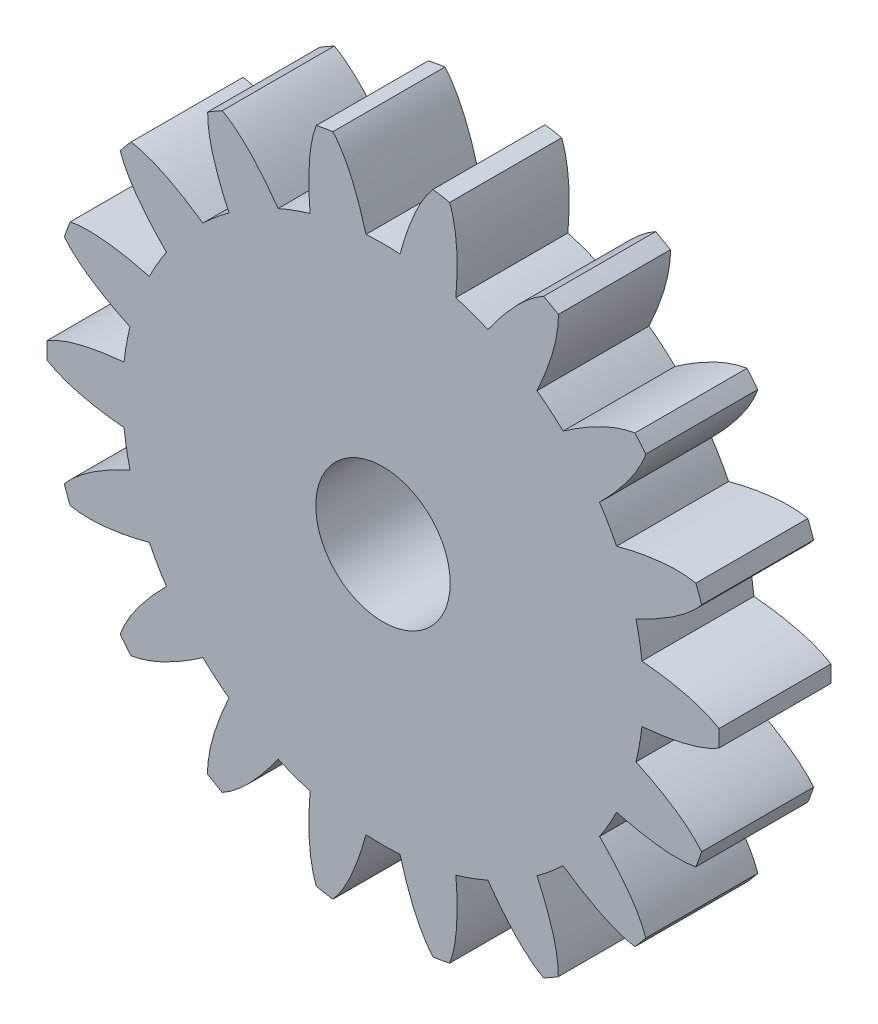
from build123d import *

# Parameters (mm, degrees)
SKETCH2_R           = 3
BOSS_EXTRUDE1_DEPTH = 5


with BuildPart() as part:
    # Sketch2 → Boss-Extrude1 (new body)
    with BuildSketch(Plane.XY):
        with BuildLine():
            ThreePointArc((-3.252993239, 11.159543494), (-3.975642146, 10.922987024), (-4.681278893, 10.639690029))
            add(Edge.make_bspline(
                [(-7.171179852, 13.174755388), (-6.030977377, 12.550803972), (-4.681278893, 10.639690029)],
                knots=[0, 0, 0, 0.715421341, 0.715421341, 0.715421341], degree=2))
            ThreePointArc((-7.171179852, 13.174755388), (-7.5, 12.990381057), (-7.824082928, 12.797801621))
            add(Edge.make_bspline(
                [(-7.824082928, 12.797801621), (-7.853826389, 11.498381604), (-6.873602407, 9.373951458)],
                knots=[0, 0, 0, 0.715421341, 0.715421341, 0.715421341], degree=2))
            ThreePointArc((-6.873602407, 9.373951458), (-7.471763175, 8.904500607), (-8.037951541, 8.39694653))
            add(Edge.make_bspline(
                [(-11.244736516, 9.927532458), (-9.95989271, 9.731182131), (-8.037951541, 8.39694653)],
                knots=[0, 0, 0, 0.715421341, 0.715421341, 0.715421341], degree=2))
            ThreePointArc((-11.244736516, 9.927532458), (-11.490666647, 9.641814145), (-11.729338937, 9.350005781))
            add(Edge.make_bspline(
                [(-11.729338937, 9.350005781), (-11.312860827, 8.118777517), (-9.665153682, 6.457722533)],
                knots=[0, 0, 0, 0.715421341, 0.715421341, 0.715421341], degree=2))
            ThreePointArc((-9.665153682, 6.457722533), (-10.066679294, 5.812), (-10.425128605, 5.141407354))
            add(Edge.make_bspline(
                [(-13.962012, 5.482902598), (-12.687497991, 5.737836107), (-10.425128605, 5.141407354)],
                knots=[0, 0, 0, 0.715421341, 0.715421341, 0.715421341], degree=2))
            ThreePointArc((-13.962012, 5.482902598), (-14.095389312, 5.13030215), (-14.219863563, 4.774461253))
            add(Edge.make_bspline(
                [(-14.219863563, 4.774461253), (-13.407397289, 3.759929041), (-11.29094478, 2.762596964)],
                knots=[0, 0, 0, 0.715421341, 0.715421341, 0.715421341], degree=2))
            ThreePointArc((-11.29094478, 2.762596964), (-11.447405321, 2.018486417), (-11.554881301, 1.265738571))
            add(Edge.make_bspline(
                [(-14.995262781, 0.376953767), (-13.884803766, 1.052422368), (-11.554881301, 1.265738571)],
                knots=[0, 0, 0, 0.715421341, 0.715421341, 0.715421341], degree=2))
            ThreePointArc((-14.995262781, 0.376953767), (-15, 0), (-14.995262781, -0.376953767))
            add(Edge.make_bspline(
                [(-14.995262781, -0.376953767), (-13.884803766, -1.052422368), (-11.554881301, -1.265738571)],
                knots=[0, 0, 0, 0.715421341, 0.715421341, 0.715421341], degree=2))
            ThreePointArc((-11.554881301, -1.265738571), (-11.447405321, -2.018486417), (-11.29094478, -2.762596964))
            add(Edge.make_bspline(
                [(-14.219863563, -4.774461253), (-13.407397289, -3.759929041), (-11.29094478, -2.762596964)],
                knots=[0, 0, 0, 0.715421341, 0.715421341, 0.715421341], degree=2))
            ThreePointArc((-14.219863563, -4.774461253), (-14.095389312, -5.13030215), (-13.962012, -5.482902598))
            add(Edge.make_bspline(
                [(-13.962012, -5.482902598), (-12.687497991, -5.737836107), (-10.425128605, -5.141407354)],
                knots=[0, 0, 0, 0.715421341, 0.715421341, 0.715421341], degree=2))
            ThreePointArc((-10.425128605, -5.141407354), (-10.066679294, -5.812), (-9.665153682, -6.457722533))
            add(Edge.make_bspline(
                [(-11.729338937, -9.350005781), (-11.312860827, -8.118777517), (-9.665153682, -6.457722533)],
                knots=[0, 0, 0, 0.715421341, 0.715421341, 0.715421341], degree=2))
            ThreePointArc((-11.729338937, -9.350005781), (-11.490666647, -9.641814145), (-11.244736516, -9.927532458))
            add(Edge.make_bspline(
                [(-11.244736516, -9.927532458), (-9.95989271, -9.731182131), (-8.037951541, -8.39694653)],
                knots=[0, 0, 0, 0.715421341, 0.715421341, 0.715421341], degree=2))
            ThreePointArc((-8.037951541, -8.39694653), (-7.471763175, -8.904500607), (-6.873602407, -9.373951458))
            add(Edge.make_bspline(
                [(-7.824082928, -12.797801621), (-7.853826389, -11.498381604), (-6.873602407, -9.373951458)],
                knots=[0, 0, 0, 0.715421341, 0.715421341, 0.715421341], degree=2))
            ThreePointArc((-7.824082928, -12.797801621), (-7.5, -12.990381057), (-7.171179852, -13.174755388))
            add(Edge.make_bspline(
                [(-7.171179852, -13.174755388), (-6.030977377, -12.550803972), (-4.681278893, -10.639690029)],
                knots=[0, 0, 0, 0.715421341, 0.715421341, 0.715421341], degree=2))
            ThreePointArc((-4.681278893, -10.639690029), (-3.975642146, -10.922987024), (-3.252993239, -11.159543494))
            add(Edge.make_bspline(
                [(-2.975127047, -14.70199371), (-3.447504579, -13.491111171), (-3.252993239, -11.159543494)],
                knots=[0, 0, 0, 0.715421341, 0.715421341, 0.715421341], degree=2))
            ThreePointArc((-2.975127047, -14.70199371), (-2.604722665, -14.772116295), (-2.232673064, -14.832908379))
            add(Edge.make_bspline(
                [(-2.232673064, -14.832908379), (-1.374637164, -13.856613624), (-0.759974923, -11.599129886)],
                knots=[0, 0, 0, 0.715421341, 0.715421341, 0.715421341], degree=2))
            ThreePointArc((-0.759974923, -11.599129886), (0, -11.624), (0.759974923, -11.599129886))
            add(Edge.make_bspline(
                [(2.232673064, -14.832908379), (1.374637164, -13.856613624), (0.759974923, -11.599129886)],
                knots=[0, 0, 0, 0.715421341, 0.715421341, 0.715421341], degree=2))
            ThreePointArc((2.232673064, -14.832908379), (2.604722665, -14.772116295), (2.975127047, -14.70199371))
            add(Edge.make_bspline(
                [(2.975127047, -14.70199371), (3.447504579, -13.491111171), (3.252993239, -11.159543494)],
                knots=[0, 0, 0, 0.715421341, 0.715421341, 0.715421341], degree=2))
            ThreePointArc((3.252993239, -11.159543494), (3.975642146, -10.922987024), (4.681278893, -10.639690029))
            add(Edge.make_bspline(
                [(7.171179852, -13.174755388), (6.030977377, -12.550803972), (4.681278893, -10.639690029)],
                knots=[0, 0, 0, 0.715421341, 0.715421341, 0.715421341], degree=2))
            ThreePointArc((7.171179852, -13.174755388), (7.5, -12.990381057), (7.824082928, -12.797801621))
            add(Edge.make_bspline(
                [(7.824082928, -12.797801621), (7.853826389, -11.498381604), (6.873602407, -9.373951458)],
                knots=[0, 0, 0, 0.715421341, 0.715421341, 0.715421341], degree=2))
            ThreePointArc((6.873602407, -9.373951458), (7.471763175, -8.904500607), (8.037951541, -8.39694653))
            add(Edge.make_bspline(
                [(11.244736516, -9.927532458), (9.95989271, -9.731182131), (8.037951541, -8.39694653)],
                knots=[0, 0, 0, 0.715421341, 0.715421341, 0.715421341], degree=2))
            ThreePointArc((11.244736516, -9.927532458), (11.490666647, -9.641814145), (11.729338937, -9.350005781))
            add(Edge.make_bspline(
                [(11.729338937, -9.350005781), (11.312860827, -8.118777517), (9.665153682, -6.457722533)],
                knots=[0, 0, 0, 0.715421341, 0.715421341, 0.715421341], degree=2))
            ThreePointArc((9.665153682, -6.457722533), (10.066679294, -5.812), (10.425128605, -5.141407354))
            add(Edge.make_bspline(
                [(13.962012, -5.482902598), (12.687497991, -5.737836107), (10.425128605, -5.141407354)],
                knots=[0, 0, 0, 0.715421341, 0.715421341, 0.715421341], degree=2))
            ThreePointArc((13.962012, -5.482902598), (14.095389312, -5.13030215), (14.219863563, -4.774461253))
            add(Edge.make_bspline(
                [(14.219863563, -4.774461253), (13.407397289, -3.759929041), (11.29094478, -2.762596964)],
                knots=[0, 0, 0, 0.715421341, 0.715421341, 0.715421341], degree=2))
            ThreePointArc((11.29094478, -2.762596964), (11.447405321, -2.018486417), (11.554881301, -1.265738571))
            add(Edge.make_bspline(
                [(14.995262781, -0.376953767), (13.884803766, -1.052422368), (11.554881301, -1.265738571)],
                knots=[0, 0, 0, 0.715421341, 0.715421341, 0.715421341], degree=2))
            ThreePointArc((14.995262781, -0.376953767), (15, 0), (14.995262781, 0.376953767))
            add(Edge.make_bspline(
                [(14.995262781, 0.376953767), (13.884803766, 1.052422368), (11.554881301, 1.265738571)],
                knots=[0, 0, 0, 0.715421341, 0.715421341, 0.715421341], degree=2))
            ThreePointArc((11.554881301, 1.265738571), (11.447405321, 2.018486417), (11.29094478, 2.762596964))
            add(Edge.make_bspline(
                [(14.219863563, 4.774461253), (13.407397289, 3.759929041), (11.29094478, 2.762596964)],
                knots=[0, 0, 0, 0.715421341, 0.715421341, 0.715421341], degree=2))
            ThreePointArc((14.219863563, 4.774461253), (14.095389312, 5.13030215), (13.962012, 5.482902598))
            add(Edge.make_bspline(
                [(13.962012, 5.482902598), (12.687497991, 5.737836107), (10.425128605, 5.141407354)],
                knots=[0, 0, 0, 0.715421341, 0.715421341, 0.715421341], degree=2))
            ThreePointArc((10.425128605, 5.141407354), (10.066679294, 5.812), (9.665153682, 6.457722533))
            add(Edge.make_bspline(
                [(11.729338937, 9.350005781), (11.312860827, 8.118777517), (9.665153682, 6.457722533)],
                knots=[0, 0, 0, 0.715421341, 0.715421341, 0.715421341], degree=2))
            ThreePointArc((11.729338937, 9.350005781), (11.490666647, 9.641814145), (11.244736516, 9.927532458))
            add(Edge.make_bspline(
                [(11.244736516, 9.927532458), (9.95989271, 9.731182131), (8.037951541, 8.39694653)],
                knots=[0, 0, 0, 0.715421341, 0.715421341, 0.715421341], degree=2))
            ThreePointArc((8.037951541, 8.39694653), (7.471763175, 8.904500607), (6.873602407, 9.373951458))
            add(Edge.make_bspline(
                [(7.824082928, 12.797801621), (7.853826389, 11.498381604), (6.873602407, 9.373951458)],
                knots=[0, 0, 0, 0.715421341, 0.715421341, 0.715421341], degree=2))
            ThreePointArc((7.824082928, 12.797801621), (7.5, 12.990381057), (7.171179852, 13.174755388))
            add(Edge.make_bspline(
                [(7.171179852, 13.174755388), (6.030977377, 12.550803972), (4.681278893, 10.639690029)],
                knots=[0, 0, 0, 0.715421341, 0.715421341, 0.715421341], degree=2))
            ThreePointArc((4.681278893, 10.639690029), (3.975642146, 10.922987024), (3.252993239, 11.159543494))
            add(Edge.make_bspline(
                [(2.975127047, 14.70199371), (3.447504579, 13.491111171), (3.252993239, 11.159543494)],
                knots=[0, 0, 0, 0.715421341, 0.715421341, 0.715421341], degree=2))
            ThreePointArc((2.975127047, 14.70199371), (2.604722665, 14.772116295), (2.232673064, 14.832908379))
            add(Edge.make_bspline(
                [(2.232673064, 14.832908379), (1.374637164, 13.856613624), (0.759974923, 11.599129886)],
                knots=[0, 0, 0, 0.715421341, 0.715421341, 0.715421341], degree=2))
            ThreePointArc((0.759974923, 11.599129886), (0, 11.624), (-0.759974923, 11.599129886))
            add(Edge.make_bspline(
                [(-2.232673064, 14.832908379), (-1.374637164, 13.856613624), (-0.759974923, 11.599129886)],
                knots=[0, 0, 0, 0.715421341, 0.715421341, 0.715421341], degree=2))
            ThreePointArc((-2.232673064, 14.832908379), (-2.604722665, 14.772116295), (-2.975127047, 14.70199371))
            add(Edge.make_bspline(
                [(-2.975127047, 14.70199371), (-3.447504579, 13.491111171), (-3.252993239, 11.159543494)],
                knots=[0, 0, 0, 0.715421341, 0.715421341, 0.715421341], degree=2))
        make_face()
        Circle(SKETCH2_R, mode=Mode.SUBTRACT)
    extrude(amount=BOSS_EXTRUDE1_DEPTH)


solid = part.part
